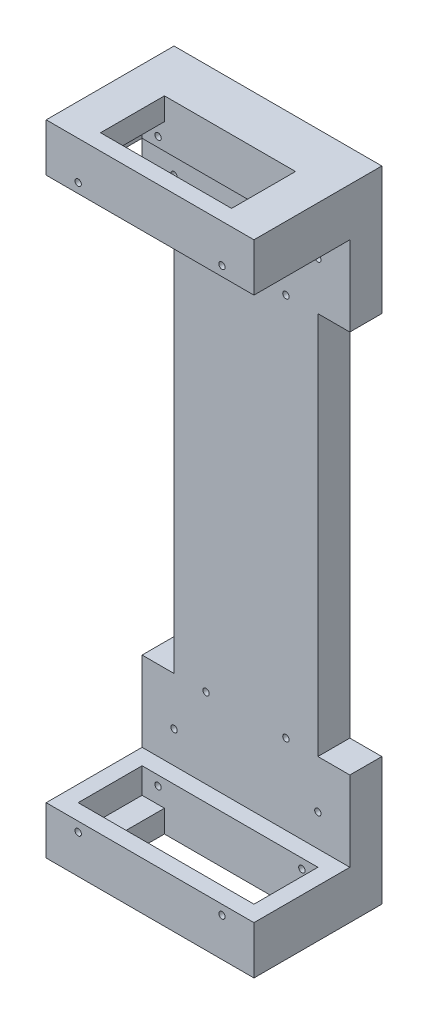
from build123d import *

# Parameters (mm, degrees)
ESQUISSE1_W                  = 65
ESQUISSE1_H                  = 200
ESQUISSE1_R                  = 1
BOSS_EXTRU_1_DEPTH           = 10
ESQUISSE2_W                  = 65
ESQUISSE2_H                  = 15
BOSS_EXTRU_2_DEPTH           = 30
ESQUISSE3_W                  = 41
ESQUISSE3_H                  = 20
ENL_V_MAT_EXTRU_1_DEPTH      = 215.067746286
ENL_V_MAT_EXTRU_2_DEPTH      = 178
ENL_V_MAT_EXTRU_2_DEPTH_BACK = 8
ESQUISSE4_W                  = 55
ESQUISSE4_H                  = 20
ESQUISSE5_R                  = 1
ENL_V_MAT_EXTRU_3_DEPTH      = 215.067746286
ESQUISSE6_W                  = 10
ESQUISSE6_H                  = 120
ENL_V_MAT_EXTRU_4_DEPTH      = 10


with BuildPart() as part:
    # Esquisse1 → Boss.-Extru.1 (new body)
    with BuildSketch(Plane.XY):
        with Locations((-32.5, -100)):
            Rectangle(ESQUISSE1_W, ESQUISSE1_H)
        with Locations((-55, -25)):
            Circle(ESQUISSE1_R, mode=Mode.SUBTRACT)
        with Locations((-45, -40)):
            Circle(ESQUISSE1_R, mode=Mode.SUBTRACT)
        with Locations((-20, -40)):
            Circle(ESQUISSE1_R, mode=Mode.SUBTRACT)
        with Locations((-10, -25)):
            Circle(ESQUISSE1_R, mode=Mode.SUBTRACT)
        with Locations((-45, -160)):
            Circle(ESQUISSE1_R, mode=Mode.SUBTRACT)
        with Locations((-20, -160)):
            Circle(ESQUISSE1_R, mode=Mode.SUBTRACT)
        with Locations((-10, -175)):
            Circle(ESQUISSE1_R, mode=Mode.SUBTRACT)
        with Locations((-55, -175)):
            Circle(ESQUISSE1_R, mode=Mode.SUBTRACT)
    extrude(amount=BOSS_EXTRU_1_DEPTH)

    # Esquisse2 → Boss.-Extru.2 (add)
    with BuildSketch(Plane.XY.offset(10)):
        with Locations((-32.5, -7.5)):
            Rectangle(ESQUISSE2_W, ESQUISSE2_H)
        with Locations((-32.5, -192.5)):
            Rectangle(ESQUISSE2_W, ESQUISSE2_H)
    extrude(amount=BOSS_EXTRU_2_DEPTH)

    # Esquisse3 → Enlèv. mat.-Extru.1 (cut, through all)
    with BuildSketch(Plane.XZ.offset(200)):
        with Locations((-32.5, 25)):
            Rectangle(ESQUISSE3_W, ESQUISSE3_H)
    extrude(amount=-ENL_V_MAT_EXTRU_1_DEPTH, mode=Mode.SUBTRACT)

    # Esquisse4 → Enlèv. mat.-Extru.2 (cut, two sides: drawn at the far end of the back side and taken through both)
    with BuildSketch(Plane.XZ.offset(15).offset(-ENL_V_MAT_EXTRU_2_DEPTH_BACK)):
        with Locations((-32.5, 25)):
            Rectangle(ESQUISSE4_W, ESQUISSE4_H)
    extrude(amount=ENL_V_MAT_EXTRU_2_DEPTH + ENL_V_MAT_EXTRU_2_DEPTH_BACK, mode=Mode.SUBTRACT)

    # Esquisse5 → Enlèv. mat.-Extru.3 (cut, through all)
    with BuildSketch(Plane.XY.offset(40)):
        with Locations((-55, -188)):
            Circle(ESQUISSE5_R)
        with Locations((-10, -188)):
            Circle(ESQUISSE5_R)
        with Locations((-10, -12)):
            Circle(ESQUISSE5_R)
        with Locations((-55, -12)):
            Circle(ESQUISSE5_R)
    extrude(amount=-ENL_V_MAT_EXTRU_3_DEPTH, mode=Mode.SUBTRACT)

    # Esquisse6 → Enlèv. mat.-Extru.4 (cut)
    with BuildSketch(Plane.XY.offset(10)):
        with Locations((-60, -100)):
            Rectangle(ESQUISSE6_W, ESQUISSE6_H)
        with Locations((-5, -100)):
            Rectangle(ESQUISSE6_W, ESQUISSE6_H)
    extrude(amount=-ENL_V_MAT_EXTRU_4_DEPTH, mode=Mode.SUBTRACT)


solid = part.part
